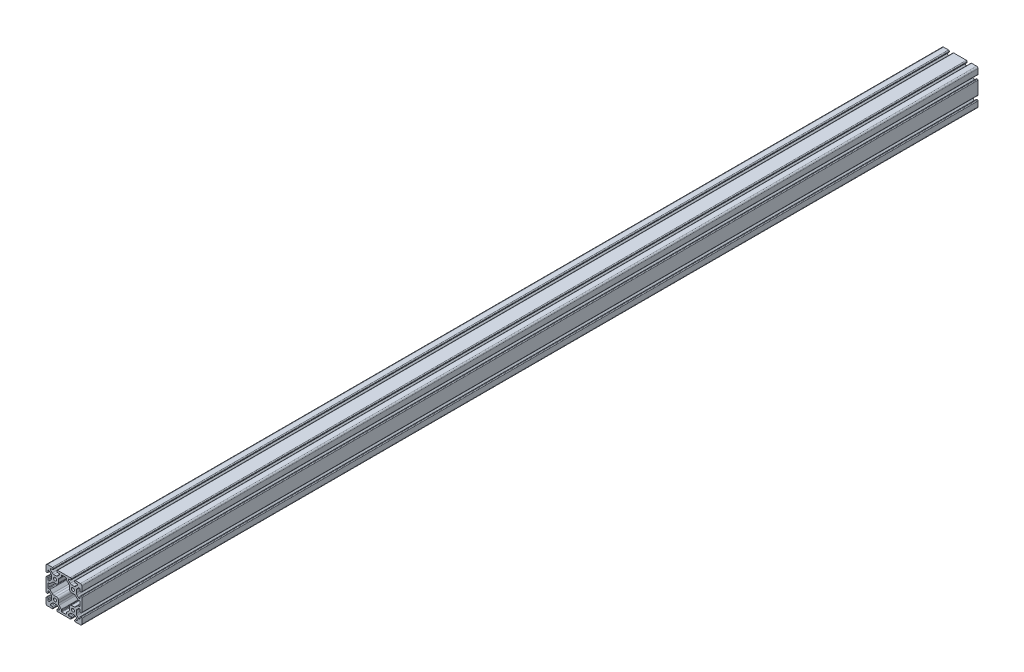
from build123d import *

# Parameters (mm, degrees)
SKETCH1_R      = 3.4
EXTRUDE1_DEPTH = 2000


with BuildPart() as part:
    # Sketch1 → Extrude1 (new body)
    with BuildSketch(Plane.XY):
        with BuildLine():
            Line((29.091242789, 26.036541495), (33.082657296, 30.027956002))
            ThreePointArc((33.082657296, 30.027956002), (33.329219041, 30.192703293), (33.62005845, 30.250554848))
            Line((33.62005845, 30.250554848), (33.955571436, 30.250554848))
            ThreePointArc((33.955571436, 30.250554848), (35.065729082, 29.790712494), (35.525571436, 28.680554848))
            Line((35.525571436, 28.680554848), (35.525571436, 25.777866899))
            ThreePointArc((35.525571436, 25.777866899), (35.985413789, 24.667709253), (37.095571436, 24.207866899))
            Line((37.095571436, 24.207866899), (38.43, 24.207866899))
            ThreePointArc((38.43, 24.207866899), (39.540157646, 24.667709253), (40, 25.777866899))
            Line((40, 25.777866899), (40, 32.933852749))
            Line((40, 32.933852749), (40, 36.83))
            ThreePointArc((40, 36.83), (39.071528496, 39.071528496), (36.83, 40))
            Line((36.83, 40), (25.540851266, 40))
            ThreePointArc((25.540851266, 40), (24.43069362, 39.540157646), (23.970851266, 38.43))
            Line((23.970851266, 38.43), (23.970851266, 37.249043598))
            ThreePointArc((23.970851266, 37.249043598), (24.43069362, 36.138885952), (25.540851266, 35.679043598))
            Line((25.540851266, 35.679043598), (28.625762638, 35.679043598))
            ThreePointArc((28.625762638, 35.679043598), (29.77116849, 35.239363487), (30.250554848, 34.11))
            Line((30.250554848, 34.11), (30.250554848, 33.62005845))
            ThreePointArc((30.250554848, 33.62005845), (30.192703293, 33.329219041), (30.027956002, 33.082657296))
            Line((30.027956002, 33.082657296), (26.036541495, 29.091242789))
            ThreePointArc((26.036541495, 29.091242789), (24.495530588, 28.061572221), (22.677784284, 27.7))
            Line((22.677784284, 27.7), (17.322215716, 27.7))
            ThreePointArc((17.322215716, 27.7), (15.504469412, 28.061572221), (13.963458505, 29.091242789))
            Line((13.963458505, 29.091242789), (9.90393336, 33.150767934))
            ThreePointArc((9.90393336, 33.150767934), (9.764102181, 33.360040084), (9.715, 33.606893415))
            Line((9.715, 33.606893415), (9.715, 34.096834965))
            ThreePointArc((9.715, 34.096834965), (10.178698303, 35.216301697), (11.298165035, 35.68))
            Line((11.298165035, 35.68), (14.642754087, 35.68))
            ThreePointArc((14.642754087, 35.68), (15.560045469, 36.059954531), (15.94, 36.977245913))
            Line((15.94, 36.977245913), (15.94, 38.194841282))
            ThreePointArc((15.94, 38.194841282), (15.411281253, 39.471281253), (14.134841282, 40))
            Line((14.134841282, 40), (6.984433948, 40))
            Line((6.984433948, 40), (-6.984433948, 40))
            Line((-6.984433948, 40), (-14.134841282, 40))
            ThreePointArc((-14.134841282, 40), (-15.411281253, 39.471281253), (-15.94, 38.194841282))
            Line((-15.94, 38.194841282), (-15.94, 36.977245913))
            ThreePointArc((-15.94, 36.977245913), (-15.560045469, 36.059954531), (-14.642754087, 35.68))
            Line((-14.642754087, 35.68), (-11.298165035, 35.68))
            ThreePointArc((-11.298165035, 35.68), (-10.178698303, 35.216301697), (-9.715, 34.096834965))
            Line((-9.715, 34.096834965), (-9.715, 33.606893415))
            ThreePointArc((-9.715, 33.606893415), (-9.764102181, 33.360040084), (-9.90393336, 33.150767934))
            Line((-9.90393336, 33.150767934), (-13.963458505, 29.091242789))
            ThreePointArc((-13.963458505, 29.091242789), (-15.504469412, 28.061572221), (-17.322215716, 27.7))
            Line((-17.322215716, 27.7), (-22.677784284, 27.7))
            ThreePointArc((-22.677784284, 27.7), (-24.495530588, 28.061572221), (-26.036541495, 29.091242789))
            Line((-26.036541495, 29.091242789), (-30.09606664, 33.150767934))
            ThreePointArc((-30.09606664, 33.150767934), (-30.235897819, 33.360040084), (-30.285, 33.606893415))
            Line((-30.285, 33.606893415), (-30.285, 34.096834965))
            ThreePointArc((-30.285, 34.096834965), (-29.821301697, 35.216301697), (-28.701834965, 35.68))
            Line((-28.701834965, 35.68), (-25.357245913, 35.68))
            ThreePointArc((-25.357245913, 35.68), (-24.439954531, 36.059954531), (-24.06, 36.977245913))
            Line((-24.06, 36.977245913), (-24.06, 38.194841282))
            ThreePointArc((-24.06, 38.194841282), (-24.588718747, 39.471281253), (-25.865158718, 40))
            Line((-25.865158718, 40), (-33.031395847, 40))
            Line((-33.031395847, 40), (-36.83, 40))
            ThreePointArc((-36.83, 40), (-39.071528496, 39.071528496), (-40, 36.83))
            Line((-40, 36.83), (-40, 33.318079463))
            Line((-40, 33.318079463), (-40, 25.865158718))
            ThreePointArc((-40, 25.865158718), (-39.471281253, 24.588718747), (-38.194841282, 24.06))
            Line((-38.194841282, 24.06), (-36.977245913, 24.06))
            ThreePointArc((-36.977245913, 24.06), (-36.059954531, 24.439954531), (-35.68, 25.357245913))
            Line((-35.68, 25.357245913), (-35.68, 28.680554848))
            ThreePointArc((-35.68, 28.680554848), (-35.220157646, 29.790712494), (-34.11, 30.250554848))
            Line((-34.11, 30.250554848), (-33.62005845, 30.250554848))
            ThreePointArc((-33.62005845, 30.250554848), (-33.329219041, 30.192703293), (-33.082657296, 30.027956002))
            Line((-33.082657296, 30.027956002), (-29.091242789, 26.036541495))
            ThreePointArc((-29.091242789, 26.036541495), (-28.061572221, 24.495530588), (-27.7, 22.677784284))
            Line((-27.7, 22.677784284), (-27.7, 17.322215716))
            ThreePointArc((-27.7, 17.322215716), (-28.061572221, 15.504469412), (-29.091242789, 13.963458505))
            Line((-29.091242789, 13.963458505), (-33.082657296, 9.972043998))
            ThreePointArc((-33.082657296, 9.972043998), (-33.329219041, 9.807296707), (-33.62005845, 9.749445152))
            Line((-33.62005845, 9.749445152), (-34.11, 9.749445152))
            ThreePointArc((-34.11, 9.749445152), (-35.220157646, 10.209287506), (-35.68, 11.319445152))
            Line((-35.68, 11.319445152), (-35.68, 14.642754087))
            ThreePointArc((-35.68, 14.642754087), (-36.059954531, 15.560045469), (-36.977245913, 15.94))
            Line((-36.977245913, 15.94), (-38.194841282, 15.94))
            ThreePointArc((-38.194841282, 15.94), (-39.471281253, 15.411281253), (-40, 14.134841282))
            Line((-40, 14.134841282), (-40, 7.016888977))
            Line((-40, 7.016888977), (-40, -7.016888977))
            Line((-40, -7.016888977), (-40, -14.447338303))
            ThreePointArc((-40, -14.447338303), (-39.540157646, -15.557495949), (-38.43, -16.017338303))
            Line((-38.43, -16.017338303), (-37.25, -16.017338303))
            ThreePointArc((-37.25, -16.017338303), (-36.139842354, -15.557495949), (-35.68, -14.447338303))
            Line((-35.68, -14.447338303), (-35.68, -11.319445152))
            ThreePointArc((-35.68, -11.319445152), (-35.220157646, -10.209287506), (-34.11, -9.749445152))
            Line((-34.11, -9.749445152), (-33.62005845, -9.749445152))
            ThreePointArc((-33.62005845, -9.749445152), (-33.329219041, -9.807296707), (-33.082657296, -9.972043998))
            Line((-33.082657296, -9.972043998), (-29.091242789, -13.963458505))
            ThreePointArc((-29.091242789, -13.963458505), (-28.061572221, -15.504469412), (-27.7, -17.322215716))
            Line((-27.7, -17.322215716), (-27.7, -22.677784284))
            ThreePointArc((-27.7, -22.677784284), (-28.061572221, -24.495530588), (-29.091242789, -26.036541495))
            Line((-29.091242789, -26.036541495), (-32.871776968, -29.817075674))
            ThreePointArc((-32.871776968, -29.817075674), (-33.10612883, -29.976640176), (-33.382654504, -30.039211548))
            Line((-33.382654504, -30.039211548), (-34.05520779, -30.062697627))
            ThreePointArc((-34.05520779, -30.062697627), (-35.200613642, -29.623017515), (-35.68, -28.493654028))
            Line((-35.68, -28.493654028), (-35.68, -25.59096608))
            ThreePointArc((-35.68, -25.59096608), (-36.139842354, -24.480808433), (-37.25, -24.02096608))
            Line((-37.25, -24.02096608), (-38.43, -24.02096608))
            ThreePointArc((-38.43, -24.02096608), (-39.540157646, -24.480808433), (-40, -25.59096608))
            Line((-40, -25.59096608), (-40, -33.019082273))
            Line((-40, -33.019082273), (-40, -36.83))
            ThreePointArc((-40, -36.83), (-39.071528496, -39.071528496), (-36.83, -40))
            Line((-36.83, -40), (-33, -40))
            Line((-33, -40), (-25.72307469, -40))
            ThreePointArc((-25.72307469, -40), (-24.612917043, -39.540157646), (-24.15307469, -38.43))
            Line((-24.15307469, -38.43), (-24.15307469, -37.25))
            ThreePointArc((-24.15307469, -37.25), (-24.612917043, -36.139842354), (-25.72307469, -35.68))
            Line((-25.72307469, -35.68), (-28.680554848, -35.68))
            ThreePointArc((-28.680554848, -35.68), (-29.790712494, -35.220157646), (-30.250554848, -34.11))
            Line((-30.250554848, -34.11), (-30.250554848, -33.62005845))
            ThreePointArc((-30.250554848, -33.62005845), (-30.192703293, -33.329219041), (-30.027956002, -33.082657296))
            Line((-30.027956002, -33.082657296), (-26.036541495, -29.091242789))
            ThreePointArc((-26.036541495, -29.091242789), (-24.495530588, -28.061572221), (-22.677784284, -27.7))
            Line((-22.677784284, -27.7), (-17.322215716, -27.7))
            ThreePointArc((-17.322215716, -27.7), (-15.504469412, -28.061572221), (-13.963458505, -29.091242789))
            Line((-13.963458505, -29.091242789), (-10.203784275, -32.85091702))
            ThreePointArc((-10.203784275, -32.85091702), (-10.044219772, -33.085268882), (-9.9816484, -33.361794556))
            Line((-9.9816484, -33.361794556), (-9.957433876, -34.05520779))
            ThreePointArc((-9.957433876, -34.05520779), (-10.397113988, -35.200613642), (-11.526477474, -35.68))
            Line((-11.526477474, -35.68), (-14.429165423, -35.68))
            ThreePointArc((-14.429165423, -35.68), (-15.539323069, -36.139842354), (-15.999165423, -37.25))
            Line((-15.999165423, -37.25), (-15.999165423, -38.43))
            ThreePointArc((-15.999165423, -38.43), (-15.539323069, -39.540157646), (-14.429165423, -40))
            Line((-14.429165423, -40), (-6.998716097, -40))
            Line((-6.998716097, -40), (6.998716097, -40))
            Line((6.998716097, -40), (14.424638994, -40))
            ThreePointArc((14.424638994, -40), (15.53479664, -39.540157646), (15.994638994, -38.43))
            Line((15.994638994, -38.43), (15.994638994, -37.032644306))
            ThreePointArc((15.994638994, -37.032644306), (15.53479664, -35.922486659), (14.424638994, -35.462644306))
            Line((14.424638994, -35.462644306), (11.382372282, -35.462644306))
            ThreePointArc((11.382372282, -35.462644306), (10.272214636, -35.002801952), (9.812372282, -33.892644306))
            Line((9.812372282, -33.892644306), (9.812372282, -33.55713132))
            ThreePointArc((9.812372282, -33.55713132), (9.870223837, -33.266291912), (10.034971128, -33.019730166))
            Line((10.034971128, -33.019730166), (13.963458505, -29.091242789))
            ThreePointArc((13.963458505, -29.091242789), (15.504469412, -28.061572221), (17.322215716, -27.7))
            Line((17.322215716, -27.7), (22.677784284, -27.7))
            ThreePointArc((22.677784284, -27.7), (24.495530588, -28.061572221), (26.036541495, -29.091242789))
            Line((26.036541495, -29.091242789), (29.794925243, -32.849626538))
            ThreePointArc((29.794925243, -32.849626538), (29.954489746, -33.083978399), (30.017061118, -33.360504074))
            Line((30.017061118, -33.360504074), (30.041320706, -34.05520779))
            ThreePointArc((30.041320706, -34.05520779), (29.601640594, -35.200613642), (28.472277108, -35.68))
            Line((28.472277108, -35.68), (25.569589159, -35.68))
            ThreePointArc((25.569589159, -35.68), (24.459431513, -36.139842354), (23.999589159, -37.25))
            Line((23.999589159, -37.25), (23.999589159, -38.43))
            ThreePointArc((23.999589159, -38.43), (24.459431513, -39.540157646), (25.569589159, -40))
            Line((25.569589159, -40), (32.999849358, -40))
            Line((32.999849358, -40), (36.83, -40))
            ThreePointArc((36.83, -40), (39.071528496, -39.071528496), (40, -36.83))
            Line((40, -36.83), (40, -33.025941835))
            Line((40, -33.025941835), (40, -25.777866899))
            ThreePointArc((40, -25.777866899), (39.540157646, -24.667709253), (38.43, -24.207866899))
            Line((38.43, -24.207866899), (37.25, -24.207866899))
            ThreePointArc((37.25, -24.207866899), (36.139842354, -24.667709253), (35.68, -25.777866899))
            Line((35.68, -25.777866899), (35.68, -28.680554848))
            ThreePointArc((35.68, -28.680554848), (35.220157646, -29.790712494), (34.11, -30.250554848))
            Line((34.11, -30.250554848), (33.62005845, -30.250554848))
            ThreePointArc((33.62005845, -30.250554848), (33.329219041, -30.192703293), (33.082657296, -30.027956002))
            Line((33.082657296, -30.027956002), (29.091242789, -26.036541495))
            ThreePointArc((29.091242789, -26.036541495), (28.061572221, -24.495530588), (27.7, -22.677784284))
            Line((27.7, -22.677784284), (27.7, -17.322215716))
            ThreePointArc((27.7, -17.322215716), (28.061572221, -15.504469412), (29.091242789, -13.963458505))
            Line((29.091242789, -13.963458505), (33.082657296, -9.972043998))
            ThreePointArc((33.082657296, -9.972043998), (33.329219041, -9.807296707), (33.62005845, -9.749445152))
            Line((33.62005845, -9.749445152), (34.11, -9.749445152))
            ThreePointArc((34.11, -9.749445152), (35.220157646, -10.209287506), (35.68, -11.319445152))
            Line((35.68, -11.319445152), (35.68, -14.222133101))
            ThreePointArc((35.68, -14.222133101), (36.139842354, -15.332290747), (37.25, -15.792133101))
            Line((37.25, -15.792133101), (38.43, -15.792133101))
            ThreePointArc((38.43, -15.792133101), (39.540157646, -15.332290747), (40, -14.222133101))
            Line((40, -14.222133101), (40, -7.021415406))
            Line((40, -7.021415406), (40, 7.021415406))
            Line((40, 7.021415406), (40, 14.222133101))
            ThreePointArc((40, 14.222133101), (39.540157646, 15.332290747), (38.43, 15.792133101))
            Line((38.43, 15.792133101), (37.25, 15.792133101))
            ThreePointArc((37.25, 15.792133101), (36.139842354, 15.332290747), (35.68, 14.222133101))
            Line((35.68, 14.222133101), (35.68, 11.319445152))
            ThreePointArc((35.68, 11.319445152), (35.220157646, 10.209287506), (34.11, 9.749445152))
            Line((34.11, 9.749445152), (33.62005845, 9.749445152))
            ThreePointArc((33.62005845, 9.749445152), (33.329219041, 9.807296707), (33.082657296, 9.972043998))
            Line((33.082657296, 9.972043998), (29.091242789, 13.963458505))
            ThreePointArc((29.091242789, 13.963458505), (28.061572221, 15.504469412), (27.7, 17.322215716))
            Line((27.7, 17.322215716), (27.7, 22.677784284))
            ThreePointArc((27.7, 22.677784284), (28.061572221, 24.495530588), (29.091242789, 26.036541495))
        make_face()
        with Locations((-20, 20)):
            Circle(SKETCH1_R, mode=Mode.SUBTRACT)
        with Locations((20, 20)):
            Circle(SKETCH1_R, mode=Mode.SUBTRACT)
        with Locations((20, -20)):
            Circle(SKETCH1_R, mode=Mode.SUBTRACT)
        with Locations((-20, -20)):
            Circle(SKETCH1_R, mode=Mode.SUBTRACT)
        with BuildLine():
            Line((17.07, 12.32), (22.657784284, 12.32))
            ThreePointArc((22.657784284, 12.32), (24.475530588, 11.958427779), (26.016541495, 10.928757211))
            Line((26.016541495, 10.928757211), (31.143879165, 5.80141954))
            ThreePointArc((31.143879165, 5.80141954), (31.555896818, 5.526118146), (32.041904777, 5.429445152))
            Line((32.041904777, 5.429445152), (34.41, 5.429445152))
            ThreePointArc((34.41, 5.429445152), (35.308025612, 5.057470764), (35.68, 4.159445152))
            Line((35.68, 4.159445152), (35.68, -4.159445152))
            ThreePointArc((35.68, -4.159445152), (35.308025612, -5.057470764), (34.41, -5.429445152))
            Line((34.41, -5.429445152), (32.041904777, -5.429445152))
            ThreePointArc((32.041904777, -5.429445152), (31.555896818, -5.526118146), (31.143879165, -5.80141954))
            Line((31.143879165, -5.80141954), (26.016541495, -10.928757211))
            ThreePointArc((26.016541495, -10.928757211), (24.475530588, -11.958427779), (22.657784284, -12.32))
            Line((22.657784284, -12.32), (17.07, -12.32))
            ThreePointArc((17.07, -12.32), (13.711242789, -13.711242789), (12.32, -17.07))
            Line((12.32, -17.07), (12.32, -22.657784284))
            ThreePointArc((12.32, -22.657784284), (11.958427779, -24.475530588), (10.928757211, -26.016541495))
            Line((10.928757211, -26.016541495), (5.80141954, -31.143879165))
            ThreePointArc((5.80141954, -31.143879165), (5.526118146, -31.555896818), (5.429445152, -32.041904777))
            Line((5.429445152, -32.041904777), (5.429445152, -34.41))
            ThreePointArc((5.429445152, -34.41), (5.057470764, -35.308025612), (4.159445152, -35.68))
            Line((4.159445152, -35.68), (-4.159445152, -35.68))
            ThreePointArc((-4.159445152, -35.68), (-5.057470764, -35.308025612), (-5.429445152, -34.41))
            Line((-5.429445152, -34.41), (-5.429445152, -32.041904777))
            ThreePointArc((-5.429445152, -32.041904777), (-5.526118146, -31.555896818), (-5.80141954, -31.143879165))
            Line((-5.80141954, -31.143879165), (-10.928757211, -26.016541495))
            ThreePointArc((-10.928757211, -26.016541495), (-11.958427779, -24.475530588), (-12.32, -22.657784284))
            Line((-12.32, -22.657784284), (-12.32, -17.07))
            ThreePointArc((-12.32, -17.07), (-13.711242789, -13.711242789), (-17.07, -12.32))
            Line((-17.07, -12.32), (-22.657784284, -12.32))
            ThreePointArc((-22.657784284, -12.32), (-24.475530588, -11.958427779), (-26.016541495, -10.928757211))
            Line((-26.016541495, -10.928757211), (-31.143879165, -5.80141954))
            ThreePointArc((-31.143879165, -5.80141954), (-31.555896818, -5.526118146), (-32.041904777, -5.429445152))
            Line((-32.041904777, -5.429445152), (-34.41, -5.429445152))
            ThreePointArc((-34.41, -5.429445152), (-35.308025612, -5.057470764), (-35.68, -4.159445152))
            Line((-35.68, -4.159445152), (-35.68, 4.159445152))
            ThreePointArc((-35.68, 4.159445152), (-35.308025612, 5.057470764), (-34.41, 5.429445152))
            Line((-34.41, 5.429445152), (-32.041904777, 5.429445152))
            ThreePointArc((-32.041904777, 5.429445152), (-31.555896818, 5.526118146), (-31.143879165, 5.80141954))
            Line((-31.143879165, 5.80141954), (-26.016541495, 10.928757211))
            ThreePointArc((-26.016541495, 10.928757211), (-24.475530588, 11.958427779), (-22.657784284, 12.32))
            Line((-22.657784284, 12.32), (-17.07, 12.32))
            ThreePointArc((-17.07, 12.32), (-13.711242789, 13.711242789), (-12.32, 17.07))
            Line((-12.32, 17.07), (-12.32, 22.657784284))
            ThreePointArc((-12.32, 22.657784284), (-11.958427779, 24.475530588), (-10.928757211, 26.016541495))
            Line((-10.928757211, 26.016541495), (-5.80141954, 31.143879165))
            ThreePointArc((-5.80141954, 31.143879165), (-5.526118146, 31.555896818), (-5.429445152, 32.041904777))
            Line((-5.429445152, 32.041904777), (-5.429445152, 34.41))
            ThreePointArc((-5.429445152, 34.41), (-5.057470764, 35.308025612), (-4.159445152, 35.68))
            Line((-4.159445152, 35.68), (4.159445152, 35.68))
            ThreePointArc((4.159445152, 35.68), (5.057470764, 35.308025612), (5.429445152, 34.41))
            Line((5.429445152, 34.41), (5.429445152, 32.041904777))
            ThreePointArc((5.429445152, 32.041904777), (5.526118146, 31.555896818), (5.80141954, 31.143879165))
            Line((5.80141954, 31.143879165), (10.928757211, 26.016541495))
            ThreePointArc((10.928757211, 26.016541495), (11.958427779, 24.475530588), (12.32, 22.657784284))
            Line((12.32, 22.657784284), (12.32, 17.07))
            ThreePointArc((12.32, 17.07), (13.711242789, 13.711242789), (17.07, 12.32))
        make_face(mode=Mode.SUBTRACT)
    extrude(amount=-EXTRUDE1_DEPTH)


solid = part.part
